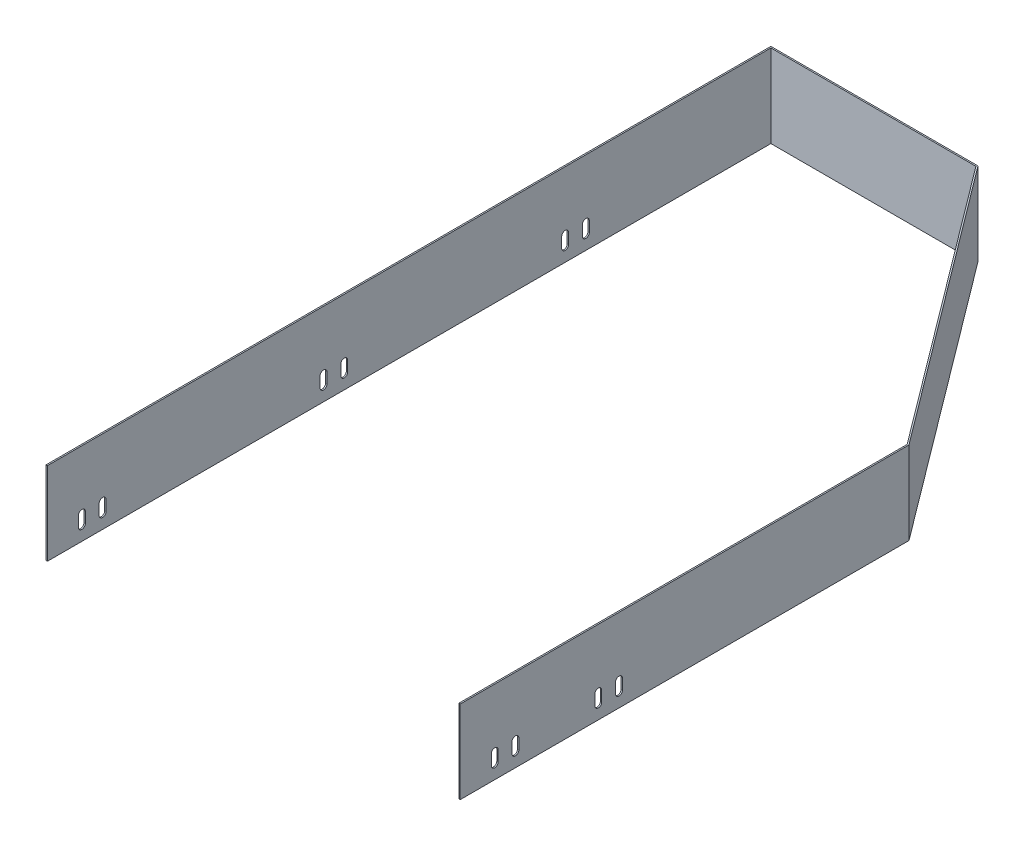
from build123d import *

# Parameters (mm, degrees)
BOSS_EXTRUDE1_DEPTH = 120
CUT_EXTRUDE2_DEPTH  = 2
CUT_EXTRUDE3_START  = -2
CUT_EXTRUDE3_DEPTH  = 2


with BuildPart() as part:
    # Sketch1 → Boss-Extrude1 (new body)
    with BuildSketch(Plane(origin=(0, 0, 0), x_dir=(1, 0, 0), z_dir=(0, 1, 0))):
        Polygon((0, 0), (0, 1050), (300, 1050), (600, 650), (600, 0), (598, 0), (598, 649.333333333), (299, 1048), (2, 1048), (2, 0), align=None)
    extrude(amount=BOSS_EXTRUDE1_DEPTH)

    # Sketch7 → Cut-Extrude2 (cut)
    with BuildSketch(Plane(origin=(600, 0, 0), x_dir=(0, 0, -1), z_dir=(1, 0, 0))):
        with BuildLine():
            Line((45, 20), (45, 35))
            ThreePointArc((45, 35), (50, 40), (55, 35))
            Line((55, 35), (55, 20))
            ThreePointArc((55, 20), (50, 15), (45, 20))
        make_face()
        with BuildLine():
            Line((75, 20), (75, 35))
            ThreePointArc((75, 35), (80, 40), (85, 35))
            Line((85, 35), (85, 20))
            ThreePointArc((85, 20), (80, 15), (75, 20))
        make_face()
        with BuildLine():
            Line((195, 20), (195, 35))
            ThreePointArc((195, 35), (200, 40), (205, 35))
            Line((205, 35), (205, 20))
            ThreePointArc((205, 20), (200, 15), (195, 20))
        make_face()
        with BuildLine():
            Line((225, 20), (225, 35))
            ThreePointArc((225, 35), (230, 40), (235, 35))
            Line((235, 35), (235, 20))
            ThreePointArc((235, 20), (230, 15), (225, 20))
        make_face()
    extrude(amount=-CUT_EXTRUDE2_DEPTH, mode=Mode.SUBTRACT)

    # Sketch8 → Cut-Extrude3 (cut)
    with BuildSketch(Plane.ZY.offset(CUT_EXTRUDE3_START)):
        with BuildLine():
            Line((-45, 35), (-45, 20))
            ThreePointArc((-45, 20), (-50, 15), (-55, 20))
            Line((-55, 20), (-55, 35))
            ThreePointArc((-55, 35), (-50, 40), (-45, 35))
        make_face()
        with BuildLine():
            Line((-75, 35), (-75, 20))
            ThreePointArc((-75, 20), (-80, 15), (-85, 20))
            Line((-85, 20), (-85, 35))
            ThreePointArc((-85, 35), (-80, 40), (-75, 35))
        make_face()
        with BuildLine():
            Line((-395, 35), (-395, 20))
            ThreePointArc((-395, 20), (-400, 15), (-405, 20))
            Line((-405, 20), (-405, 35))
            ThreePointArc((-405, 35), (-400, 40), (-395, 35))
        make_face()
        with BuildLine():
            Line((-425, 35), (-425, 20))
            ThreePointArc((-425, 20), (-430, 15), (-435, 20))
            Line((-435, 20), (-435, 35))
            ThreePointArc((-435, 35), (-430, 40), (-425, 35))
        make_face()
        with BuildLine():
            Line((-745, 35), (-745, 20))
            ThreePointArc((-745, 20), (-750, 15), (-755, 20))
            Line((-755, 20), (-755, 35))
            ThreePointArc((-755, 35), (-750, 40), (-745, 35))
        make_face()
        with BuildLine():
            Line((-775, 35), (-775, 20))
            ThreePointArc((-775, 20), (-780, 15), (-785, 20))
            Line((-785, 20), (-785, 35))
            ThreePointArc((-785, 35), (-780, 40), (-775, 35))
        make_face()
    extrude(amount=CUT_EXTRUDE3_DEPTH, mode=Mode.SUBTRACT)


solid = part.part
